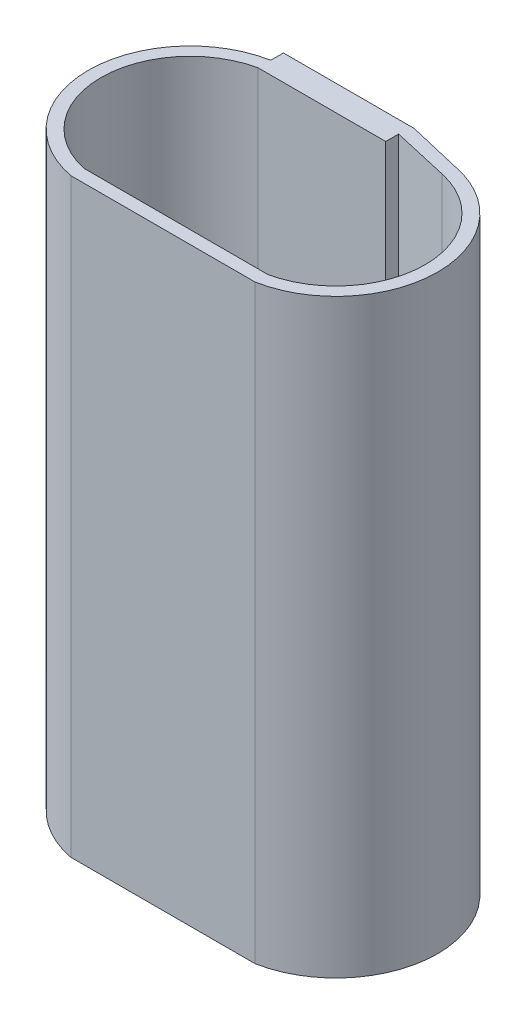
from build123d import *

# Parameters (mm, degrees)
BOSS_EXTRUDE1_DEPTH = 70.45
SKETCH2_R           = 0.574746223
SKETCH2_R_2         = 0.572709313
BOSS_EXTRUDE2_DEPTH = 2


with BuildPart() as part:
    # Sketch1 → Boss-Extrude1 (new body)
    with BuildSketch(Plane(origin=(0, 0, 0), x_dir=(1, 0, 0), z_dir=(0, 1, 0))):
        with BuildLine():
            Line((-10.463385515, 13.437573917), (-10.463385515, 11.929541616))
            ThreePointArc((-10.463385515, 11.929541616), (-20.316677089, 0), (-10.463385515, -11.929541616))
            Line((-10.463385515, -11.929541616), (11.536614485, -11.929541616))
            ThreePointArc((11.536614485, -11.929541616), (21.38990606, 0), (11.536614485, 11.929541616))
            Line((11.536614485, 11.929541616), (5.132924913, 13.437573917))
            Line((5.132924913, 13.437573917), (-10.463385515, 13.437573917))
        make_face()
        with BuildLine():
            ThreePointArc((-10.463385515, -10.389541616), (-18.808385515, 0), (-10.463385515, 10.389541616))
            Line((-10.463385515, 10.389541616), (4.788760706, 10.389541616))
            Line((4.788760706, 10.389541616), (4.788760706, 11.929541616))
            Line((4.788760706, 11.929541616), (11.536614485, 10.389541616))
            ThreePointArc((11.536614485, 10.389541616), (19.881614485, 0), (11.536614485, -10.389541616))
            Line((11.536614485, -10.389541616), (-10.463385515, -10.389541616))
        make_face(mode=Mode.SUBTRACT)
    extrude(amount=BOSS_EXTRUDE1_DEPTH)

    # Sketch2 → Boss-Extrude2 (add)
    with BuildSketch(Plane.ZY.offset(10.463385515)):
        with Locations(Location((-12.681906896, 34.013885353, 0), (0, 0, 180))):
            Circle(SKETCH2_R)
        with Locations(Location((-12.681906896, 36.442241885, 0), (0, 0, 180))):
            Circle(SKETCH2_R_2)
    extrude(amount=BOSS_EXTRUDE2_DEPTH)


solid = part.part
